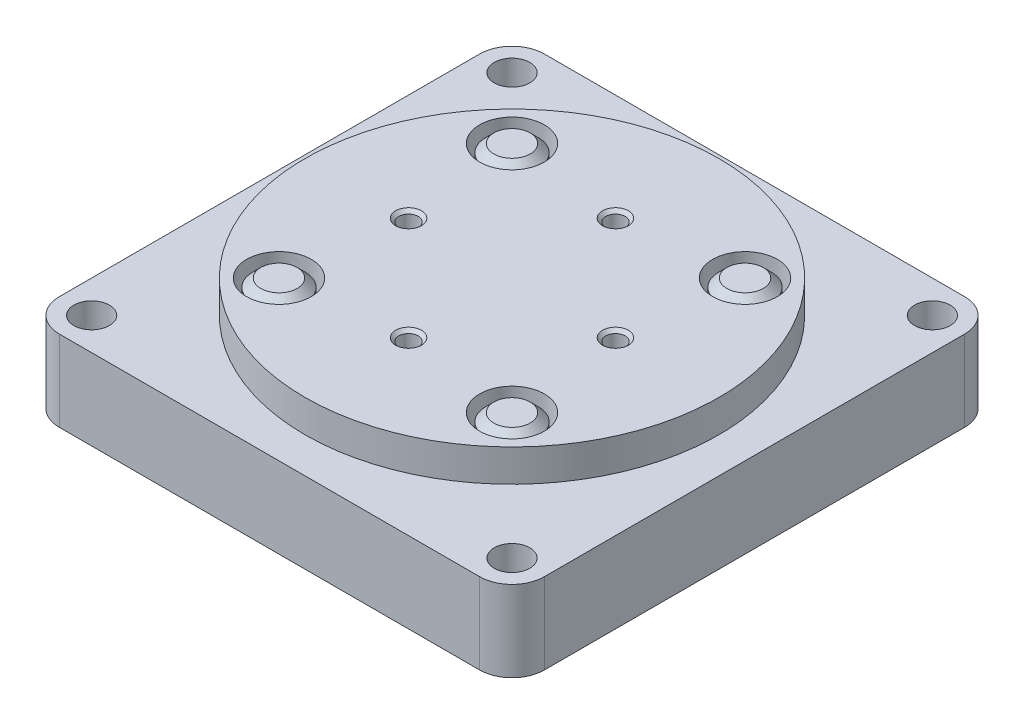
from build123d import *

# Parameters (mm, degrees)
SKETCH1_W           = 76.2
SKETCH1_H           = 76.2
BOSS_EXTRUDE1_DEPTH = 12.7
SKETCH2_R           = 2.794
CUT_EXTRUDE1_DEPTH  = 56.358016583
SKETCH2_3_R         = 32.512
BOSS_EXTRUDE2_DEPTH = 5.08
FILLET1_R           = 5.08
SKETCH3_R           = 5.08
SKETCH3_R_2         = 4.1275
SKETCH3_R_3         = 1.524
CUT_EXTRUDE2_DEPTH  = 7.62
CHAMFER1_SIZE       = 1.27
CHAMFER2_SIZE       = 0.508


with BuildPart() as part:
    # Sketch1 → Boss-Extrude1 (new body)
    with BuildSketch(Plane(origin=(0, 0, 0), x_dir=(1, 0, 0), z_dir=(0, 1, 0))):
        Rectangle(SKETCH1_W, SKETCH1_H)
    extrude(amount=BOSS_EXTRUDE1_DEPTH)

    # Sketch2 → Cut-Extrude1 (cut, through all)
    with BuildSketch(Plane(origin=(0, 12.7, 0), x_dir=(1, 0, 0), z_dir=(0, 1, 0))):
        with Locations((33.02, 33.02)):
            Circle(SKETCH2_R)
        with Locations((33.02, -33.02)):
            Circle(SKETCH2_R)
        with Locations((-33.02, -33.02)):
            Circle(SKETCH2_R)
        with Locations((-33.02, 33.02)):
            Circle(SKETCH2_R)
    extrude(amount=-CUT_EXTRUDE1_DEPTH, mode=Mode.SUBTRACT)

    # Sketch2<3> → Boss-Extrude2 (add)
    with BuildSketch(Plane(origin=(0, 12.7, 0), x_dir=(1, 0, 0), z_dir=(0, 1, 0))):
        Circle(SKETCH2_3_R)
    extrude(amount=BOSS_EXTRUDE2_DEPTH)

    # Fillet1
    fillet1_edges = [part.edges().sort_by_distance(p)[0] for p in [
        (-38.1, 6.35, 38.1),
        (38.1, 6.35, 38.1),
        (38.1, 6.35, -38.1),
        (-38.1, 6.35, -38.1),
    ]]
    fillet(fillet1_edges, radius=FILLET1_R)

    # Sketch3 → Cut-Extrude2 (cut)
    # profile 1 of 8: a face of its own
    with BuildSketch(Plane(origin=(0, 17.78, 0), x_dir=(1, 0, 0), z_dir=(0, 1, 0))):
        with Locations((18.306051224, 18.306051224)):
            Circle(SKETCH3_R)
        with Locations((18.306051224, 18.306051224)):
            Circle(SKETCH3_R_2, mode=Mode.SUBTRACT)
    # profile 2 of 8: a face of its own
    with BuildSketch(Plane(origin=(0, 17.78, 0), x_dir=(1, 0, 0), z_dir=(0, 1, 0))):
        with Locations((18.306051224, -18.306051224)):
            Circle(SKETCH3_R)
        with Locations((18.306051224, -18.306051224)):
            Circle(SKETCH3_R_2, mode=Mode.SUBTRACT)
    # profile 3 of 8: a face of its own
    with BuildSketch(Plane(origin=(0, 17.78, 0), x_dir=(1, 0, 0), z_dir=(0, 1, 0))):
        with Locations((-18.306051224, -18.306051224)):
            Circle(SKETCH3_R)
        with Locations((-18.306051224, -18.306051224)):
            Circle(SKETCH3_R_2, mode=Mode.SUBTRACT)
    # profile 4 of 8: a face of its own
    with BuildSketch(Plane(origin=(0, 17.78, 0), x_dir=(1, 0, 0), z_dir=(0, 1, 0))):
        with Locations((-18.306051224, 18.306051224)):
            Circle(SKETCH3_R)
        with Locations((-18.306051224, 18.306051224)):
            Circle(SKETCH3_R_2, mode=Mode.SUBTRACT)
    # profile 5 of 8: a face of its own
    with BuildSketch(Plane(origin=(0, 17.78, 0), x_dir=(1, 0, 0), z_dir=(0, 1, 0))):
        with Locations((0, 16.256)):
            Circle(SKETCH3_R_3)
    # profile 6 of 8: a face of its own
    with BuildSketch(Plane(origin=(0, 17.78, 0), x_dir=(1, 0, 0), z_dir=(0, 1, 0))):
        with Locations((16.256, 0)):
            Circle(SKETCH3_R_3)
    # profile 7 of 8: a face of its own
    with BuildSketch(Plane(origin=(0, 17.78, 0), x_dir=(1, 0, 0), z_dir=(0, 1, 0))):
        with Locations((0, -16.256)):
            Circle(SKETCH3_R_3)
    # profile 8 of 8: a face of its own
    with BuildSketch(Plane(origin=(0, 17.78, 0), x_dir=(1, 0, 0), z_dir=(0, 1, 0))):
        with Locations((-16.256, 0)):
            Circle(SKETCH3_R_3)
    extrude(amount=-CUT_EXTRUDE2_DEPTH, mode=Mode.SUBTRACT)

    # Chamfer1
    chamfer1_edges = [part.edges().sort_by_distance(p)[0] for p in [
        (14.178551224, 17.78, 18.306051224),
        (14.178551224, 17.78, -18.306051224),
        (-22.433551224, 17.78, -18.306051224),
        (-22.433551224, 17.78, 18.306051224),
    ]]
    chamfer(chamfer1_edges, length=CHAMFER1_SIZE)

    # Chamfer2
    chamfer2_edges = [part.edges().sort_by_distance(p)[0] for p in [
        (-1.524, 17.78, 16.256),
        (14.732, 17.78, 0),
        (-1.524, 17.78, -16.256),
        (-17.78, 17.78, 0),
    ]]
    chamfer(chamfer2_edges, length=CHAMFER2_SIZE)


solid = part.part
